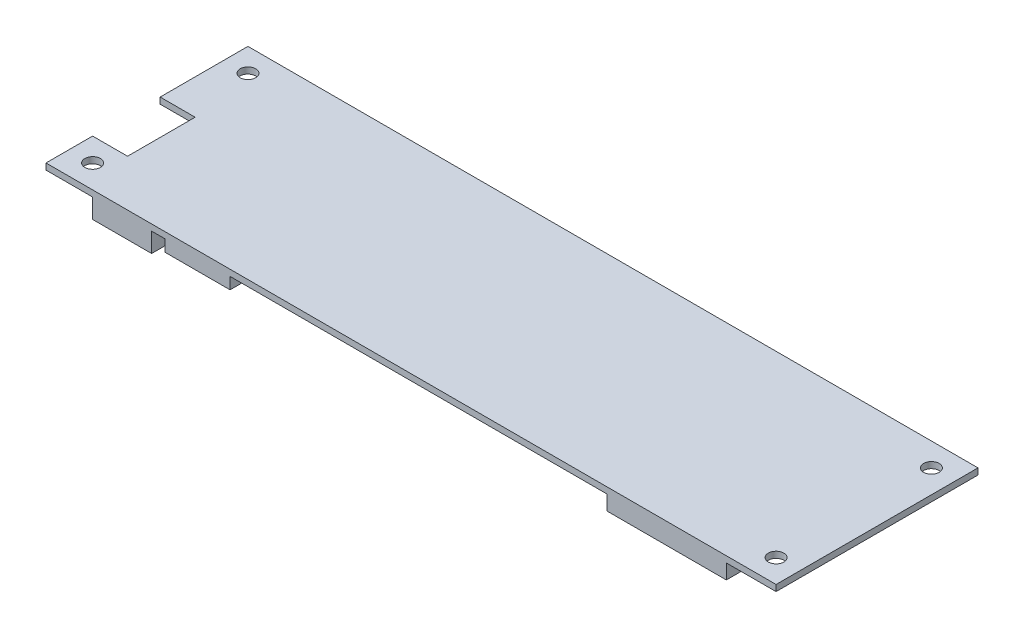
from build123d import *

# Parameters (mm, degrees)
SKETCH_1_W          = 94
SKETCH_1_H          = 26
SKETCH_1_R          = 1
EXTRUDE_1_DEPTH     = 0.8
SKETCH_3_W          = 15.4
SKETCH_3_H          = 15.1
EXTRUDE_4_DEPTH     = 1.9
SKETCH_3_3_W        = 6.7
SKETCH_3_3_H        = 6.2
EXTRUDE_5_DEPTH     = 1
SKETCH_3_4_W        = 8.4
SKETCH_3_4_H        = 5.9
EXTRUDE_6_DEPTH     = 1.5
SKETCH_3_5_W        = 7.6
SKETCH_3_5_H        = 5.9
EXTRUDE_7_DEPTH     = 2.5
SKETCH_3_6_W        = 4.5
SKETCH_3_6_H        = 8.7
CUT_EXTRUDE_1_DEPTH = 49.828782496


with BuildPart() as part:
    # 草图1 → 凸台-拉伸1 (new body)
    with BuildSketch(Plane(origin=(0, 0, 0), x_dir=(1, 0, 0), z_dir=(0, 1, 0))):
        Rectangle(SKETCH_1_W, SKETCH_1_H)
        with Locations((-44, 10)):
            Circle(SKETCH_1_R, mode=Mode.SUBTRACT)
        with Locations((-44, -10)):
            Circle(SKETCH_1_R, mode=Mode.SUBTRACT)
        with Locations((44, 10)):
            Circle(SKETCH_1_R, mode=Mode.SUBTRACT)
        with Locations((44, -10)):
            Circle(SKETCH_1_R, mode=Mode.SUBTRACT)
    extrude(amount=EXTRUDE_1_DEPTH)

    # 草图3 → 凸台-拉伸4 (add)
    with BuildSketch(Plane.XZ):
        with Locations((32.9, 5.45)):
            Rectangle(SKETCH_3_W, SKETCH_3_H)
    extrude(amount=EXTRUDE_4_DEPTH)

    # 草图3<3> → 凸台-拉伸5 (add)
    with BuildSketch(Plane.XZ):
        with Locations((-27.35, 0)):
            Rectangle(SKETCH_3_3_W, SKETCH_3_3_H)
        with Locations((-16.075, 0)):
            Rectangle(SKETCH_3_3_W, SKETCH_3_3_H)
        with Locations((-4.8, 0)):
            Rectangle(SKETCH_3_3_W, SKETCH_3_3_H)
        with Locations((6.475, 0)):
            Rectangle(SKETCH_3_3_W, SKETCH_3_3_H)
        with Locations((17.75, 0)):
            Rectangle(SKETCH_3_3_W, SKETCH_3_3_H)
    extrude(amount=EXTRUDE_5_DEPTH)

    # 草图3<4> → 凸台-拉伸6 (add)
    with BuildSketch(Plane.XZ):
        with Locations((-27.5, 10.05)):
            Rectangle(SKETCH_3_4_W, SKETCH_3_4_H)
    extrude(amount=EXTRUDE_6_DEPTH)

    # 草图3<5> → 凸台-拉伸7 (add)
    with BuildSketch(Plane.XZ):
        with Locations((-37.2, 10.05)):
            Rectangle(SKETCH_3_5_W, SKETCH_3_5_H)
    extrude(amount=EXTRUDE_7_DEPTH)

    # 草图3<6> → 切除-拉伸1 (cut, through all)
    with BuildSketch(Plane.XZ):
        with Locations((-44.75, 2.65)):
            Rectangle(SKETCH_3_6_W, SKETCH_3_6_H)
    extrude(amount=-CUT_EXTRUDE_1_DEPTH, mode=Mode.SUBTRACT)


solid = part.part
